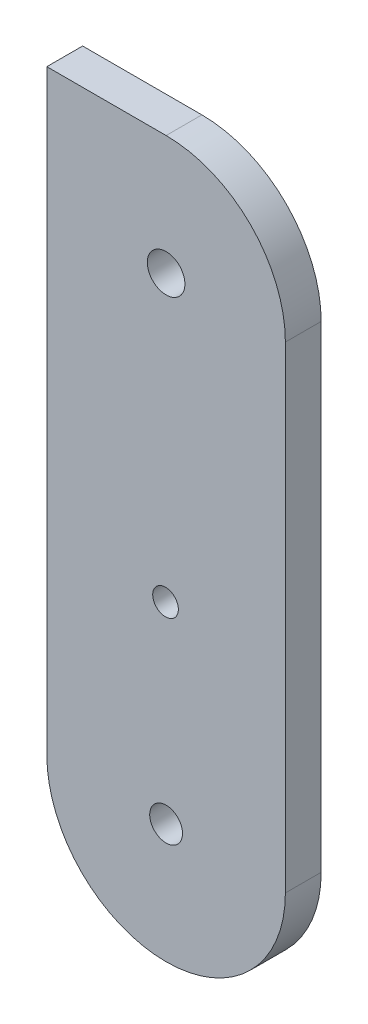
from build123d import *

# Parameters (mm, degrees)
SKETCH1_R           = 1.075
SKETCH1_R_2         = 1.375
BOSS_EXTRUDE1_DEPTH = 3
BOSS_EXTRUDE2_DEPTH = 4
SKETCH3_R           = 1.575
CUT_EXTRUDE1_DEPTH  = 10


with BuildPart() as part:
    # Sketch1 → Boss-Extrude1 (new body)
    with BuildSketch(Plane.XY):
        with BuildLine():
            Line((-26.25, 89.183481687), (-26.25, 39.183481687))
            ThreePointArc((-26.25, 39.183481687), (-16.25, 29.183481687), (-6.25, 39.183481687))
            Line((-6.25, 39.183481687), (-6.25, 79.183481687))
            ThreePointArc((-6.25, 79.183481687), (-9.178932188, 86.254549499), (-16.25, 89.183481687))
            Line((-16.25, 89.183481687), (-26.25, 89.183481687))
        make_face()
        with Locations((-16.298780591, 55.283407788)):
            Circle(SKETCH1_R, mode=Mode.SUBTRACT)
        with Locations((-16.25, 39.183481687)):
            Circle(SKETCH1_R_2, mode=Mode.SUBTRACT)
    extrude(amount=BOSS_EXTRUDE1_DEPTH)

    # Sketch1<4> → Boss-Extrude2 (add)
    with BuildSketch(Plane.XY):
        with BuildLine():
            ThreePointArc((-13.036870696, 55.991806015), (-16.287526809, 59.183775163), (-19.535875527, 55.989457894))
            Line((-19.535875527, 55.989457894), (-21.249709959, 39.23733634))
            ThreePointArc((-21.249709959, 39.23733634), (-16.248864162, 34.183481816), (-11.250315025, 39.239607879))
            Line((-11.250315025, 39.239607879), (-13.036870696, 55.991806015))
        make_face()
        with BuildLine():
            Line((-20.25, 39.183481687), (-18.536352569, 55.933775375))
            ThreePointArc((-18.536352569, 55.933775375), (-16.286352569, 58.183775375), (-14.036352569, 55.933775375))
            Line((-14.036352569, 55.933775375), (-12.25, 39.183481687))
            ThreePointArc((-12.25, 39.183481687), (-16.25, 35.183481687), (-20.25, 39.183481687))
        make_face(mode=Mode.SUBTRACT)
    extrude(amount=-BOSS_EXTRUDE2_DEPTH)

    # Sketch3 → Cut-Extrude1 (cut)
    with BuildSketch(Plane.XY.offset(3)):
        with Locations((-16.25, 79.183481687)):
            Circle(SKETCH3_R)
    extrude(amount=-CUT_EXTRUDE1_DEPTH, mode=Mode.SUBTRACT)


solid = part.part
